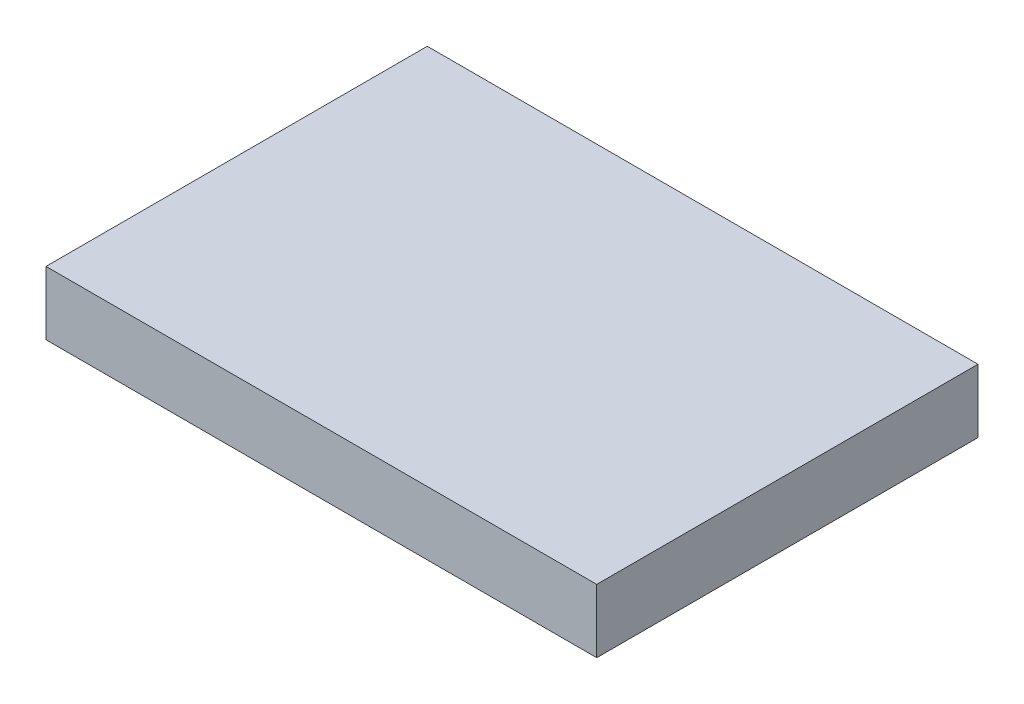
from build123d import *

# Parameters (mm, degrees)
SKETCH_1_W      = 260
SKETCH_1_H      = 30
EXTRUDE_1_DEPTH = 180


with BuildPart() as part:
    # 草图1 → 凸台-拉伸1 (new body)
    with BuildSketch(Plane.XY):
        Rectangle(SKETCH_1_W, SKETCH_1_H)
    extrude(amount=EXTRUDE_1_DEPTH)


solid = part.part
